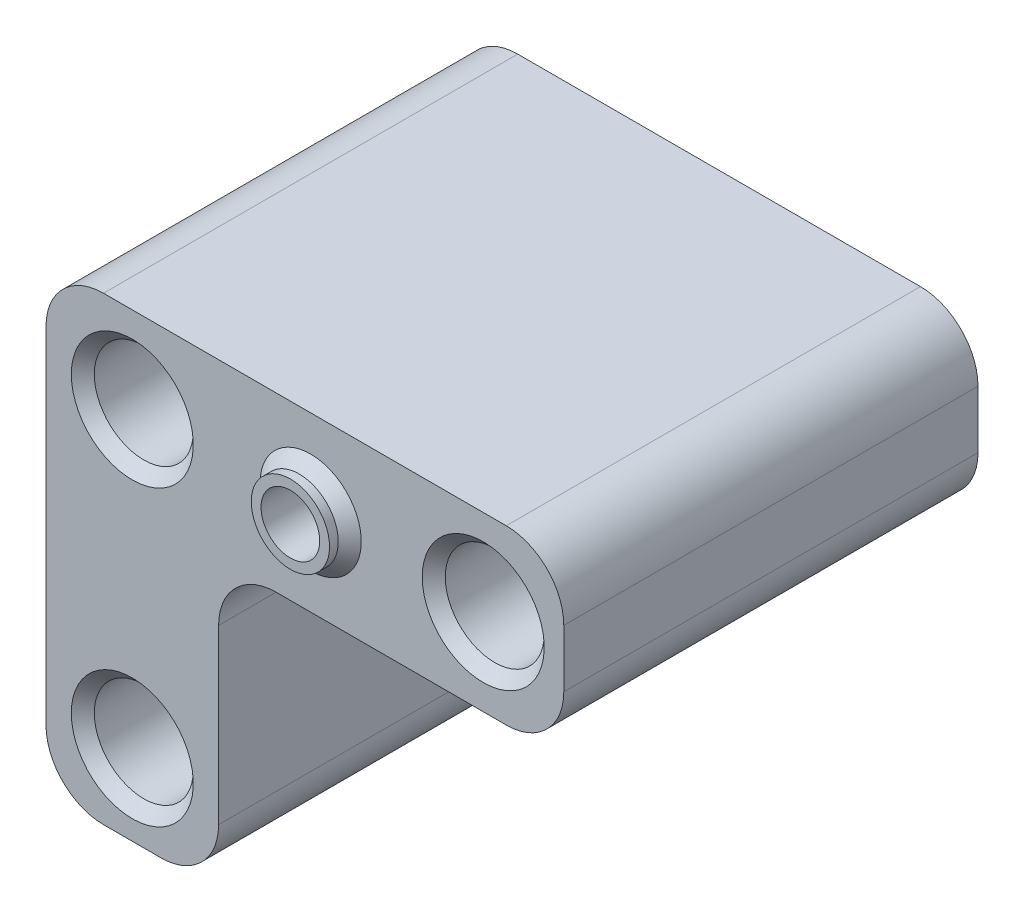
from build123d import *

# Parameters (mm, degrees)
SKETCH2_R           = 2.55
SKETCH2_W           = 30
SKETCH2_H           = 15
BOSS_EXTRUDE1_DEPTH = 36
SKETCH3_R           = 4.3
CUT_EXTRUDE1_DEPTH  = 30.6
SKETCH4_R           = 4.05
CUT_EXTRUDE2_DEPTH  = 31.6
FILLET1_R           = 5
CHAMFER1_SIZE       = 1
SKETCH8_R           = 2.55
CUT_EXTRUDE3_DEPTH  = 10
SKETCH9_R           = 3.4
SKETCH9_R_2         = 2.55
BOSS_EXTRUDE3_DEPTH = 1.76
CHAMFER3_SIZE       = 1
CHAMFER4_SIZE       = 1


with BuildPart() as part:
    # Sketch2 → Boss-Extrude1 (new body)
    # profile 1 of 2: a face of its own
    with BuildSketch(Plane.XY):
        Polygon((-326.5, 320), (-311.5, 320), (-311.5, 345), (-311.5, 360), (-326.5, 360), align=None)
        with Locations((-319, 327)):
            Circle(SKETCH2_R, mode=Mode.SUBTRACT)
        with Locations((-319, 352.5)):
            Circle(SKETCH2_R, mode=Mode.SUBTRACT)
    # profile 2 of 2: a face of its own
    with BuildSketch(Plane.XY):
        with Locations((-296.5, 352.5)):
            Rectangle(SKETCH2_W, SKETCH2_H)
        with Locations((-288.5, 352.5)):
            Circle(SKETCH2_R, mode=Mode.SUBTRACT)
    extrude(amount=BOSS_EXTRUDE1_DEPTH)

    # Sketch3 → Cut-Extrude1 (cut)
    with BuildSketch(Plane.XY.offset(36)):
        with Locations((-319, 352.5)):
            Circle(SKETCH3_R)
        with Locations((-319, 327)):
            Circle(SKETCH3_R)
        with Locations((-288.5, 352.5)):
            Circle(SKETCH3_R)
    extrude(amount=-CUT_EXTRUDE1_DEPTH, mode=Mode.SUBTRACT)

    # Sketch4 → Cut-Extrude2 (cut)
    with BuildSketch(Plane(origin=(0, 0, 0), x_dir=(-1, 0, 0), z_dir=(0, 0, -1))):
        with Locations((303.5, 352.5)):
            Circle(SKETCH4_R)
        Polygon((307.55, 354.83826859), (303.5, 357.17653718), (299.45, 354.83826859), (299.45, 350.16173141), (303.5, 347.82346282), (307.55, 350.16173141), align=None)
    extrude(amount=-CUT_EXTRUDE2_DEPTH, mode=Mode.SUBTRACT)

    # Fillet1
    fillet1_edges = [part.edges().sort_by_distance(p)[0] for p in [
        (-311.5, 345, 18),
        (-281.5, 345, 18),
        (-281.5, 360, 18),
        (-311.5, 320, 18),
        (-326.5, 320, 18),
        (-326.5, 360, 18),
    ]]
    fillet(fillet1_edges, radius=FILLET1_R)

    # Chamfer1
    chamfer1_edges = [part.edges().sort_by_distance(p)[0] for p in [
        (-292.8, 352.5, 36),
        (-323.3, 327, 36),
        (-323.3, 352.5, 36),
    ]]
    chamfer(chamfer1_edges, length=CHAMFER1_SIZE)

    # Sketch8 → Cut-Extrude3 (cut)
    with BuildSketch(Plane(origin=(0, 0, 31.6), x_dir=(-1, 0, 0), z_dir=(0, 0, -1))):
        with Locations((303.5, 352.5)):
            Circle(SKETCH8_R)
    extrude(amount=-CUT_EXTRUDE3_DEPTH, mode=Mode.SUBTRACT)

    # Sketch9 → Boss-Extrude3 (add)
    with BuildSketch(Plane.XY.offset(36)):
        with Locations(Location((-303.5, 352.5, 0), (0, 0, 180))):
            Circle(SKETCH9_R)
        with Locations(Location((-303.5, 352.5, 0), (0, 0, 180))):
            Circle(SKETCH9_R_2, mode=Mode.SUBTRACT)
    extrude(amount=BOSS_EXTRUDE3_DEPTH)

    # Chamfer3
    chamfer3_edges = [part.edges().sort_by_distance(p)[0] for p in [
        (-300.1, 352.5, 36),
    ]]
    chamfer(chamfer3_edges, length=CHAMFER3_SIZE)

    # Chamfer4
    chamfer4_edges = [part.edges().sort_by_distance(p)[0] for p in [
        (-305.525, 348.992597115, 0),
        (-307.55, 352.5, 0),
        (-305.525, 356.007402885, 0),
        (-301.475, 356.007402885, 0),
        (-299.45, 352.5, 0),
        (-301.475, 348.992597115, 0),
    ]]
    chamfer(chamfer4_edges, length=CHAMFER4_SIZE)


solid = part.part
